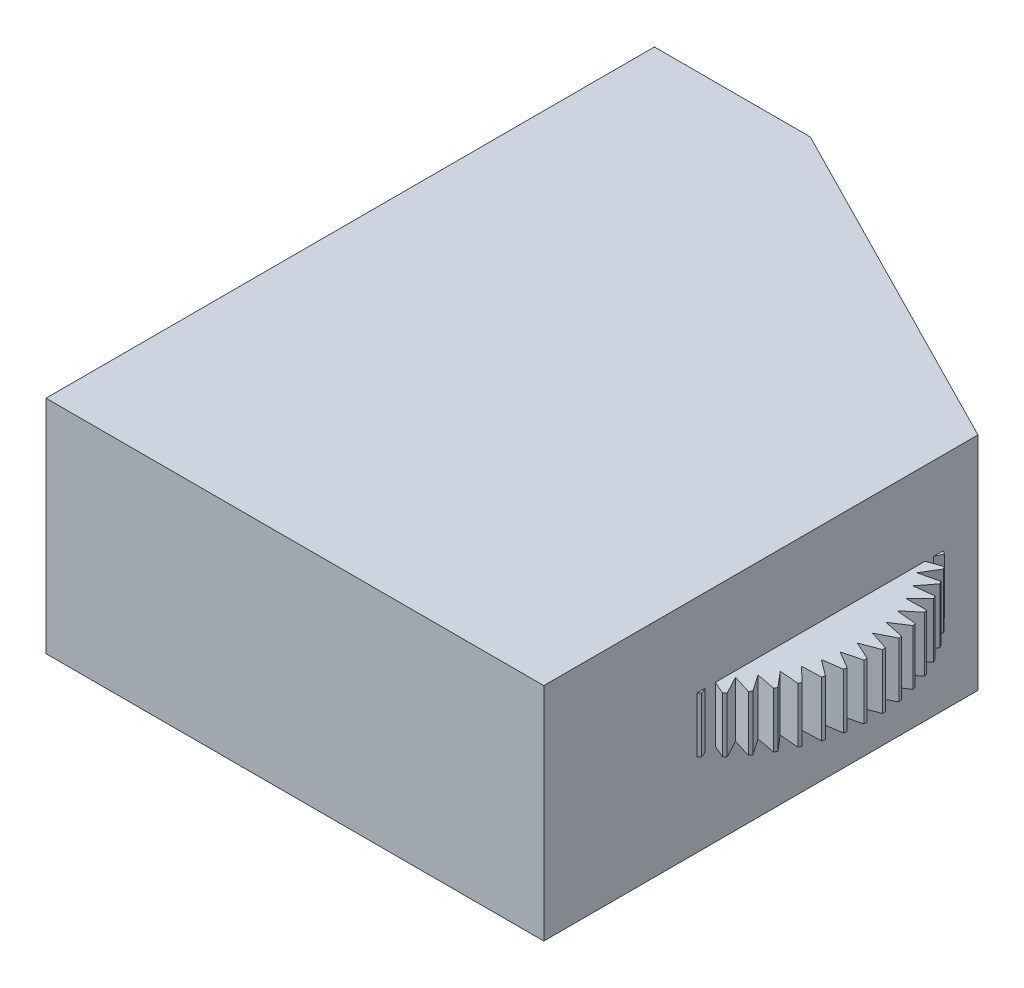
from build123d import *

# Parameters (mm, degrees)
BOSS_EXTRUDE3_DEPTH = 12.7
BOSS_EXTRUDE5_DEPTH = 3.175
CHAMFER1_SIZE       = 10
CHAMFER1_SIZE2      = 19.626105055


with BuildPart() as part:
    # Sketch1 → Boss-Extrude3 (new body)
    with BuildSketch(Plane(origin=(0, 0, 0), x_dir=(1, 0, 0), z_dir=(0, 1, 0))):
        Polygon((0, 20.6375), (0, 34.925), (28.575, 34.925), (28.575, 0), (12.7, 0), (7.9375, 0), (0, 0), (0, 15.875), align=None)
    extrude(amount=BOSS_EXTRUDE3_DEPTH)

    # Sketch8 → Boss-Extrude5 (add)
    with BuildSketch(Plane(origin=(0, 4.7625, 0), x_dir=(1, 0, 0), z_dir=(0, 1, 0))):
        with BuildLine():
            Line((31.738320164, 15.403444634), (30.693867565, 15.875))
            Line((30.693867565, 15.875), (31.741764678, 16.270998814))
            ThreePointArc((31.741764678, 16.270998814), (31.737544766, 16.361946694), (31.732455721, 16.452850083))
            Line((31.732455721, 16.452850083), (30.642467275, 16.806645055))
            Line((30.642467275, 16.806645055), (31.640441237, 17.315517721))
            ThreePointArc((31.640441237, 17.315517721), (31.626241922, 17.405449384), (31.611183644, 17.495241214))
            Line((31.611183644, 17.495241214), (30.488890335, 17.7269812))
            Line((30.488890335, 17.7269812), (31.424827094, 18.342550695))
            ThreePointArc((31.424827094, 18.342550695), (31.400820737, 18.430374492), (31.375976014, 18.517964812))
            Line((31.375976014, 18.517964812), (30.235000961, 18.624836803))
            Line((30.235000961, 18.624836803), (31.097539513, 19.339630946))
            ThreePointArc((31.097539513, 19.339630946), (31.064017519, 19.424280815), (31.02968793, 19.508606397))
            Line((31.02968793, 19.508606397), (29.883881026, 19.489313112))
            Line((29.883881026, 19.489313112), (30.662551321, 20.29465527))
            ThreePointArc((30.662551321, 20.29465527), (30.619920601, 20.375103677), (30.576522862, 20.455140923))
            Line((30.576522862, 20.455140923), (29.43979265, 20.309916556))
            Line((29.43979265, 20.309916556), (30.125142686, 21.196030966))
            ThreePointArc((30.125142686, 21.196030966), (30.073920719, 21.271301376), (30.02198162, 21.346078743))
            Line((30.02198162, 21.346078743), (28.908126465, 21.076686121))
            Line((28.908126465, 21.076686121), (29.49183702, 22.032816555))
            ThreePointArc((29.49183702, 22.032816555), (29.432645572, 22.101995287), (29.372795584, 22.170605078))
            Line((29.372795584, 22.170605078), (28.295336177, 21.780314262))
            Line((28.295336177, 21.780314262), (28.770321797, 22.794854592))
            ThreePointArc((28.770321797, 22.794854592), (28.703879372, 22.85710191), (28.636844991, 22.918711295))
            Line((28.636844991, 22.918711295), (27.608860232, 22.412259888))
            Line((27.608860232, 22.412259888), (27.969355234, 23.472894968))
            ThreePointArc((27.969355234, 23.472894968), (27.896468352, 23.527455275), (27.823063286, 23.581316399))
            Line((27.823063286, 23.581316399), (26.857031516, 22.964852035))
            Line((26.857031516, 22.964852035), (27.098659979, 24.058707192))
            ThreePointArc((27.098659979, 24.058707192), (27.02021339, 24.104918198), (26.941328676, 24.150377261))
            Line((26.941328676, 24.150377261), (26.048976213, 23.431382982))
            Line((26.048976213, 23.431382982), (26.168805095, 24.545180296))
            ThreePointArc((26.168805095, 24.545180296), (26.085751033, 24.582481063), (26.002344225, 24.618986254))
            Line((26.002344225, 24.618986254), (25.194503018, 23.806189675))
            Line((25.194503018, 23.806189675), (25.191077759, 24.926409157))
            ThreePointArc((25.191077759, 24.926409157), (25.104424388, 24.954346904), (25.017507932, 24.981455098))
            Line((25.017507932, 24.981455098), (24.30398408, 24.08472247))
            Line((24.30398408, 24.08472247), (24.177346257, 25.197766172))
            ThreePointArc((24.177346257, 25.197766172), (24.088145431, 25.216001772), (23.998774375, 25.233383913))
            Line((23.998774375, 25.233383913), (23.388229091, 24.263600355))
            Line((23.388229091, 24.263600355), (23.139915917, 25.355957434))
            ThreePointArc((23.139915917, 25.355957434), (23.049250413, 25.364269532), (22.9585096, 25.371714625))
            Line((22.9585096, 25.371714625), (22.458354076, 24.340651996))
            Line((22.458354076, 24.340651996), (22.091379736, 25.399062716))
            ThreePointArc((22.091379736, 25.399062716), (22.000350112, 25.397350415), (21.909341013, 25.394768086))
            Line((21.909341013, 25.394768086), (21.52564646, 24.314942089))
            Line((21.52564646, 24.314942089), (21.044465525, 25.326558779))
            ThreePointArc((21.044465525, 25.326558779), (20.954176755, 25.314842863), (20.864004098, 25.302264458))
            Line((20.864004098, 25.302264458), (20.601428047, 24.186782718))
            Line((20.601428047, 24.186782718), (20.011881402, 25.139325721))
            ThreePointArc((20.011881402, 25.139325721), (19.923429472, 25.117748406), (19.835187829, 25.09532661))
            Line((19.835187829, 25.09532661), (19.696917599, 23.957729565))
            Line((19.696917599, 23.957729565), (19.006161542, 24.839636299))
            ThreePointArc((19.006161542, 24.839636299), (18.920620137, 24.808459505), (18.835380643, 24.776466487))
            Line((18.835380643, 24.776466487), (18.823094647, 23.630563023))
            Line((18.823094647, 23.630563023), (18.03951402, 24.431128337))
            ThreePointArc((18.03951402, 24.431128337), (17.957921497, 24.390730506), (17.876718844, 24.349554619))
            Line((17.876718844, 24.349554619), (17.990566217, 23.209254453))
            Line((17.990566217, 23.209254453), (17.123672628, 23.918760566))
            ThreePointArc((17.123672628, 23.918760566), (17.04701941, 23.869632075), (16.970839288, 23.819773138))
            Line((16.970839288, 23.819773138), (17.209438078, 22.698917969))
            Line((17.209438078, 22.698917969), (16.26975444, 23.308752439))
            ThreePointArc((16.26975444, 23.308752439), (16.198970993, 23.25148964), (16.128738126, 23.193552874))
            Line((16.128738126, 23.193552874), (16.489192065, 22.105748364))
            Line((16.489192065, 22.105748364), (15.488124866, 22.608508627))
            ThreePointArc((15.488124866, 22.608508627), (15.424070405, 22.543806613), (15.360637325, 22.478495291))
            Line((15.360637325, 22.478495291), (15.838570992, 21.436945915))
            Line((15.838570992, 21.436945915), (14.78827183, 21.826529142))
            ThreePointArc((14.78827183, 21.826529142), (14.73172389, 21.755173308), (14.675860587, 21.683280221))
            Line((14.675860587, 21.683280221), (15.265472515, 20.700628977))
            Line((15.265472515, 20.700628977), (14.1786906, 20.972306155))
            ThreePointArc((14.1786906, 20.972306155), (14.130335596, 20.895162665), (14.082720176, 20.817560498))
            Line((14.082720176, 20.817560498), (14.776853274, 19.90573544))
            Line((14.776853274, 19.90573544), (13.666780666, 20.056208776))
            ThreePointArc((13.666780666, 20.056208776), (13.627205562, 19.974214047), (13.588416012, 19.891844785))
            Line((13.588416012, 19.891844785), (14.378644445, 19.061914235))
            Line((14.378644445, 19.061914235), (13.258755922, 19.089357187))
            ThreePointArc((13.258755922, 19.089357187), (13.228441106, 19.003506523), (13.198948279, 18.917370018))
            Line((13.198948279, 18.917370018), (14.075679743, 18.179408208))
            Line((14.075679743, 18.179408208), (12.959569234, 18.083487656))
            ThreePointArc((12.959569234, 18.083487656), (12.938882688, 17.994823169), (12.919044586, 17.905965))
            Line((12.919044586, 17.905965), (13.87163675, 17.268929787))
            Line((13.87163675, 17.268929787), (12.772852325, 17.050810077))
            ThreePointArc((12.772852325, 17.050810077), (12.762045155, 16.960408033), (12.752102586, 16.869906818))
            Line((12.752102586, 16.869906818), (13.768992271, 16.341530947))
            Line((13.768992271, 16.341530947), (12.700871685, 16.003859756))
            ThreePointArc((12.700871685, 16.003859756), (12.700075075, 15.912817513), (12.700148728, 15.821771815))
            Line((12.700148728, 15.821771815), (13.768992271, 15.408469053))
            Line((13.768992271, 15.408469053), (12.74450106, 14.955345252))
            ThreePointArc((12.74450106, 14.955345252), (12.75372468, 14.86476794), (12.763813661, 14.774282931))
            Line((12.763813661, 14.774282931), (13.87163675, 14.481070213))
            Line((13.87163675, 14.481070213), (12.90321085, 13.917994111))
            ThreePointArc((12.90321085, 13.917994111), (12.922342738, 13.828981216), (12.942324581, 13.74015526))
            Line((12.942324581, 13.74015526), (14.075679743, 13.570591792))
            Line((14.075679743, 13.570591792), (13.175074533, 12.90439837))
            ThreePointArc((13.175074533, 12.90439837), (13.203882453, 12.818030388), (13.233514605, 12.731941713))
            Line((13.233514605, 12.731941713), (14.378644445, 12.688085765))
            Line((14.378644445, 12.688085765), (13.556792052, 11.926861709))
            ThreePointArc((13.556792052, 11.926861709), (13.594926315, 11.844187031), (13.633849082, 11.761880635))
            Line((13.633849082, 11.761880635), (14.776853274, 11.84426456))
            Line((14.776853274, 11.84426456), (14.043729872, 10.997250099))
            ThreePointArc((14.043729872, 10.997250099), (14.090727581, 10.919272282), (14.138468493, 10.841747255))
            Line((14.138468493, 10.841747255), (15.265472515, 11.049371023))
            Line((15.265472515, 11.049371023), (14.62997723, 10.126847765))
            ThreePointArc((14.62997723, 10.126847765), (14.685267895, 10.054513355), (14.741247443, 9.982710745))
            Line((14.741247443, 9.982710745), (15.838570992, 10.313054085))
            Line((15.838570992, 10.313054085), (15.308417875, 9.326220212))
            ThreePointArc((15.308417875, 9.326220212), (15.371330343, 9.260407251), (15.43486901, 9.195198645))
            Line((15.43486901, 9.195198645), (16.489192065, 9.644251636))
            Line((16.489192065, 9.644251636), (16.070816458, 8.605085975))
            ThreePointArc((16.070816458, 8.605085975), (16.140587057, 8.546593343), (16.21091357, 8.488770284))
            Line((16.21091357, 8.488770284), (17.209438078, 9.051082031))
            Line((17.209438078, 9.051082031), (16.907918492, 7.972198646))
            ThreePointArc((16.907918492, 7.972198646), (16.983700301, 7.921736364), (17.059960992, 7.872000747))
            Line((17.059960992, 7.872000747), (17.990566217, 8.540745547))
            Line((17.990566217, 8.540745547), (17.809562694, 7.43524062))
            ThreePointArc((17.809562694, 7.43524062), (17.890435824, 7.393421231), (17.971704991, 7.352376779))
            Line((17.971704991, 7.352376779), (18.823094647, 8.119436977))
            Line((18.823094647, 8.119436977), (18.764804323, 7.00072984))
            ThreePointArc((18.764804323, 7.00072984), (18.849787085, 6.968060976), (18.93507823, 6.936205912))
            Line((18.93507823, 6.936205912), (19.696917599, 7.792270435))
            Line((19.696917599, 7.792270435), (19.76204804, 6.673940678))
            ThreePointArc((19.76204804, 6.673940678), (19.850108857, 6.650818895), (19.938386662, 6.628539897))
            Line((19.938386662, 6.628539897), (20.601428047, 7.563217282))
            Line((20.601428047, 7.563217282), (20.789188657, 6.458839913))
            ThreePointArc((20.789188657, 6.458839913), (20.879258592, 6.445545877), (20.969451482, 6.433113381))
            Line((20.969451482, 6.433113381), (21.52564646, 7.435057911))
            Line((21.52564646, 7.435057911), (21.833758079, 6.358038575))
            ThreePointArc((21.833758079, 6.358038575), (21.924743803, 6.354733658), (22.015756961, 6.352298579))
            Line((22.015756961, 6.352298579), (22.458354076, 7.409348004))
            Line((22.458354076, 7.409348004), (22.883076648, 6.372760257))
            Line((22.883076648, 6.372760257), (23.064602367, 6.387076472))
            Line((23.064602367, 6.387076472), (23.388229091, 7.486399645))
            Line((23.388229091, 7.486399645), (23.924407058, 6.502826258))
            ThreePointArc((23.924407058, 6.502826258), (24.013913322, 6.519498189), (24.103256138, 6.537024905))
            Line((24.103256138, 6.537024905), (24.30398408, 7.66527753))
            Line((24.30398408, 7.66527753), (24.945108969, 6.746657752))
            Line((24.945108969, 6.746657752), (25.119110423, 6.800323705))
            Line((25.119110423, 6.800323705), (25.194503018, 7.943810325))
            Line((25.194503018, 7.943810325), (25.932792441, 7.101294955))
            ThreePointArc((25.932792441, 7.101294955), (26.016486493, 7.137136693), (26.099834128, 7.173776783))
            Line((26.099834128, 7.173776783), (26.048976213, 8.318617018))
            Line((26.048976213, 8.318617018), (26.875468336, 7.562433052))
            ThreePointArc((26.875468336, 7.562433052), (26.954711536, 7.607264289), (27.033522596, 7.652850923))
            Line((27.033522596, 7.652850923), (26.857031516, 8.785147965))
            Line((26.857031516, 8.785147965), (27.761693845, 8.124474452))
            ThreePointArc((27.761693845, 8.124474452), (27.835524287, 8.177750997), (27.908842114, 8.231730816))
            Line((27.908842114, 8.231730816), (27.608860232, 9.337740112))
            Line((27.608860232, 9.337740112), (28.58071139, 8.780596732))
            ThreePointArc((28.58071139, 8.780596732), (28.648232874, 8.84167188), (28.715167487, 8.903389642))
            Line((28.715167487, 8.903389642), (28.295336177, 9.969685738))
            Line((28.295336177, 9.969685738), (29.322579209, 9.522835458))
            ThreePointArc((29.322579209, 9.522835458), (29.382972116, 9.59096784), (29.44271102, 9.659674374))
            Line((29.44271102, 9.659674374), (28.908126465, 10.673313879))
            Line((28.908126465, 10.673313879), (29.978292032, 10.342180857))
            ThreePointArc((29.978292032, 10.342180857), (30.030823272, 10.416543437), (30.082641317, 10.49140474))
            Line((30.082641317, 10.49140474), (29.43979265, 11.440083444))
            Line((29.43979265, 11.440083444), (30.539890392, 11.228687185))
            ThreePointArc((30.539890392, 11.228687185), (30.583922307, 11.308377303), (30.627190494, 11.388484659))
            Line((30.627190494, 11.388484659), (29.883881026, 12.260686888))
            Line((29.883881026, 12.260686888), (31.000557246, 12.171593456))
            ThreePointArc((31.000557246, 12.171593456), (31.035555349, 12.255643782), (31.06974846, 12.340024797))
            Line((31.06974846, 12.340024797), (30.235000961, 13.125163197))
            Line((30.235000961, 13.125163197), (31.354700723, 13.159454066))
            ThreePointArc((31.354700723, 13.159454066), (31.380240185, 13.246844343), (31.404943161, 13.334474745))
            Line((31.404943161, 13.334474745), (30.488890335, 14.0230188))
            Line((30.488890335, 14.0230188), (31.598022, 14.180277726))
            ThreePointArc((31.598022, 14.180277726), (31.613792806, 14.269947153), (31.628705787, 14.359763229))
            Line((31.628705787, 14.359763229), (30.642467275, 14.943354945))
            Line((30.642467275, 14.943354945), (31.727567487, 15.221673018))
            ThreePointArc((31.727567487, 15.221673018), (31.733378201, 15.31253313), (31.738320164, 15.403444634))
        make_face()
    extrude(amount=BOSS_EXTRUDE5_DEPTH)

    # Chamfer1
    chamfer1_edges = [part.edges().sort_by_distance(p)[0] for p in [
        (28.575, 6.35, -34.925),
    ]]
    chamfer1_side = [part.faces().sort_by_distance(p)[0] for p in [
        (28.575, 6.35, -34.553375778),
    ]]
    chamfer(chamfer1_edges, length=CHAMFER1_SIZE, length2=CHAMFER1_SIZE2, reference=chamfer1_side[0])


solid = part.part
